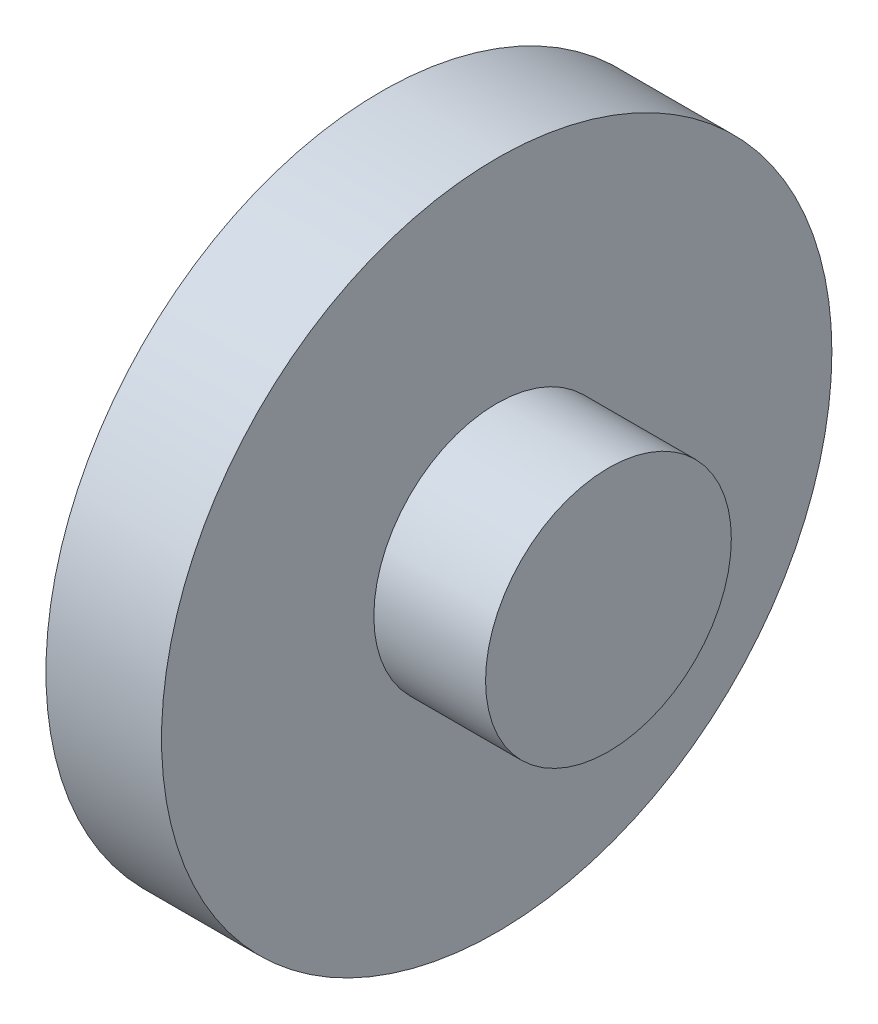
from build123d import *

# Parameters (mm, degrees)
SKETCH1_R           = 15
SKETCH1_W           = 3.175
SKETCH1_H           = 16.7
BOSS_EXTRUDE1_DEPTH = 4.175
SKETCH2_R           = 15
BOSS_EXTRUDE2_DEPTH = 1
SKETCH3_R           = 5.5
BOSS_EXTRUDE3_DEPTH = 5


with BuildPart() as part:
    # Sketch1 → Boss-Extrude1 (new body)
    with BuildSketch(Plane(origin=(0, 0, 0), x_dir=(0, 0, -1), z_dir=(1, 0, 0))):
        Circle(SKETCH1_R)
        Rectangle(SKETCH1_W, SKETCH1_H, mode=Mode.SUBTRACT)
    extrude(amount=BOSS_EXTRUDE1_DEPTH)

    # Sketch2 → Boss-Extrude2 (add)
    with BuildSketch(Plane(origin=(4.175, 0, 0), x_dir=(0, 0, -1), z_dir=(1, 0, 0))):
        Circle(SKETCH2_R)
    extrude(amount=BOSS_EXTRUDE2_DEPTH)

    # Sketch3 → Boss-Extrude3 (add)
    with BuildSketch(Plane(origin=(5.175, 0, 0), x_dir=(0, 0, -1), z_dir=(1, 0, 0))):
        Circle(SKETCH3_R)
    extrude(amount=BOSS_EXTRUDE3_DEPTH)


solid = part.part
